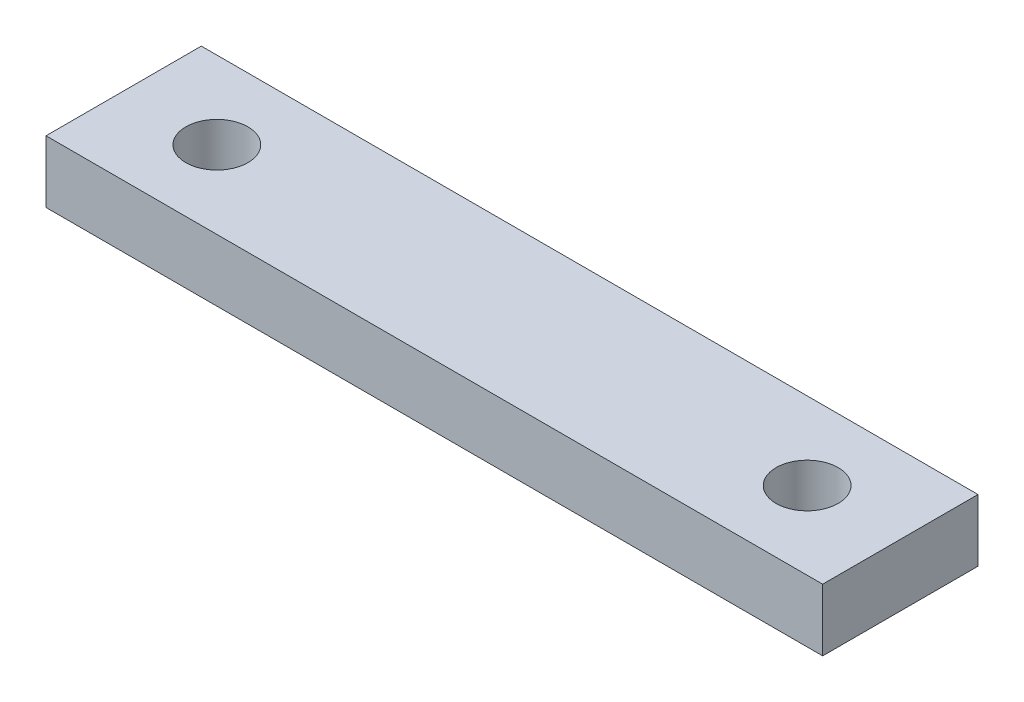
from build123d import *

# Parameters (mm, degrees)
SKETCH1_W           = 50
SKETCH1_H           = 10
SKETCH1_R           = 2
BOSS_EXTRUDE1_DEPTH = 4


with BuildPart() as part:
    # Sketch1 → Boss-Extrude1 (new body)
    with BuildSketch(Plane(origin=(0, 0, 0), x_dir=(1, 0, 0), z_dir=(0, 1, 0))):
        Rectangle(SKETCH1_W, SKETCH1_H)
        with Locations(Location((19, 0, 0), (0, 0, 270))):
            Circle(SKETCH1_R, mode=Mode.SUBTRACT)
        with Locations(Location((-19, 0, 0), (0, 0, 90))):
            Circle(SKETCH1_R, mode=Mode.SUBTRACT)
    extrude(amount=BOSS_EXTRUDE1_DEPTH)


solid = part.part
